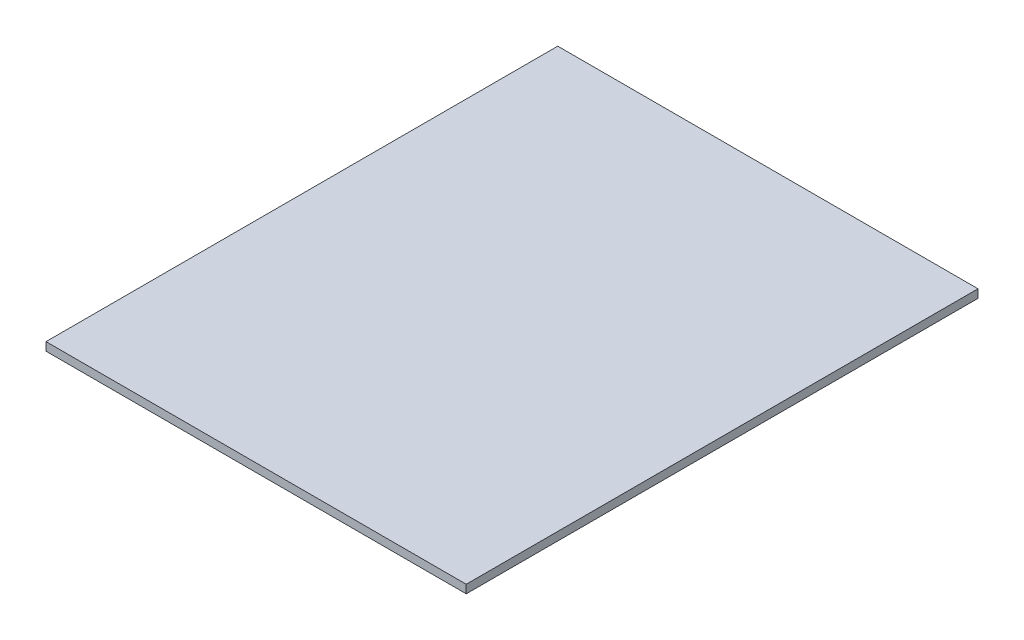
from build123d import *

# Parameters (mm, degrees)
SKETCH1_W           = 404
SKETCH1_H           = 492
BOSS_EXTRUDE3_DEPTH = 8


with BuildPart() as part:
    # Sketch1 → Boss-Extrude3 (new body)
    with BuildSketch(Plane(origin=(0, 0, 0), x_dir=(1, 0, 0), z_dir=(0, 1, 0))):
        with Locations((202, -246)):
            Rectangle(SKETCH1_W, SKETCH1_H)
    extrude(amount=BOSS_EXTRUDE3_DEPTH)


solid = part.part
